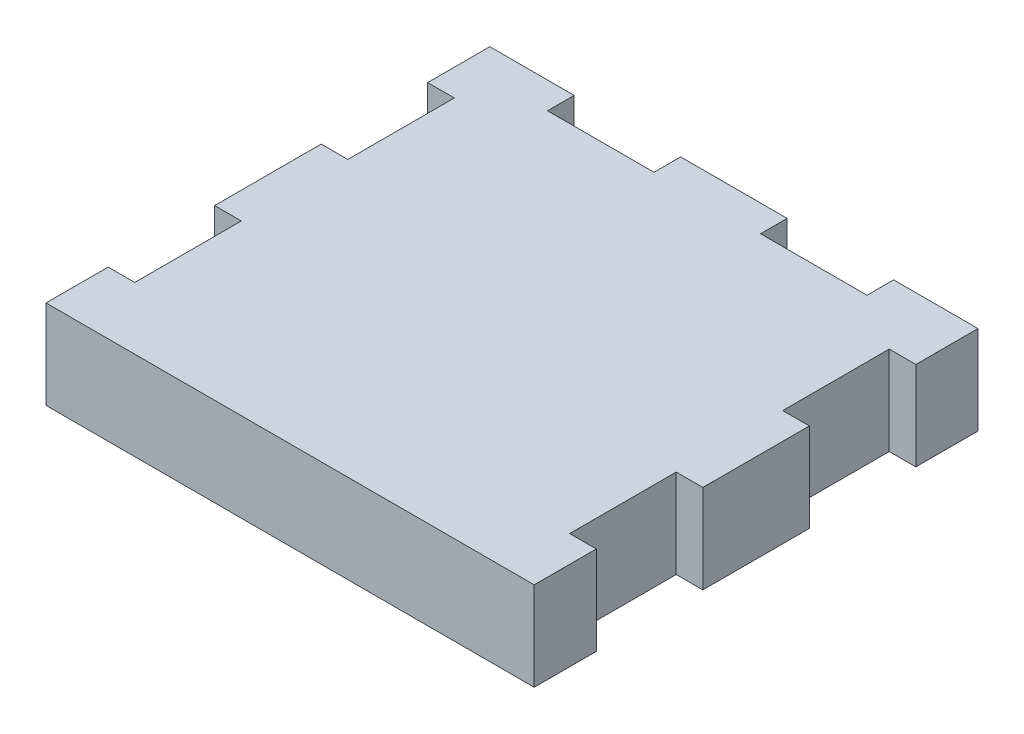
from build123d import *

# Parameters (mm, degrees)
BOSS_EXTRUDE1_DEPTH = 10


with BuildPart() as part:
    # Sketch1 → Boss-Extrude1 (new body)
    with BuildSketch(Plane(origin=(0, 0, 0), x_dir=(1, 0, 0), z_dir=(0, 1, 0))):
        Polygon((-135.812908411, 125.703692436), (-126.31291151, 125.703692436), (-126.31291151, 122.703686357), (-114.312909544, 122.703686357), (-114.312909544, 125.703692436), (-102.312915027, 125.703692436), (-102.312915027, 122.703686357), (-90.31291306, 122.703686357), (-90.31291306, 125.703692436), (-80.812908709, 125.703692436), (-80.812908709, 122.703686357), (-80.812908709, 118.703693151), (-83.812914789, 118.703693151), (-83.812914789, 106.703691185), (-80.812908709, 106.703691185), (-80.812908709, 94.703689218), (-83.812914789, 94.703689218), (-83.812914789, 82.703687251), (-80.812908709, 82.703687251), (-80.812908709, 75.703687966), (-135.812908411, 75.703687966), (-135.812908411, 82.703687251), (-132.812917233, 82.703687251), (-132.812917233, 94.703689218), (-135.812908411, 94.703689218), (-135.812908411, 106.703691185), (-132.812917233, 106.703691185), (-132.812917233, 118.703693151), (-135.812908411, 118.703693151), (-135.812908411, 122.703686357), align=None)
    extrude(amount=BOSS_EXTRUDE1_DEPTH)


solid = part.part
